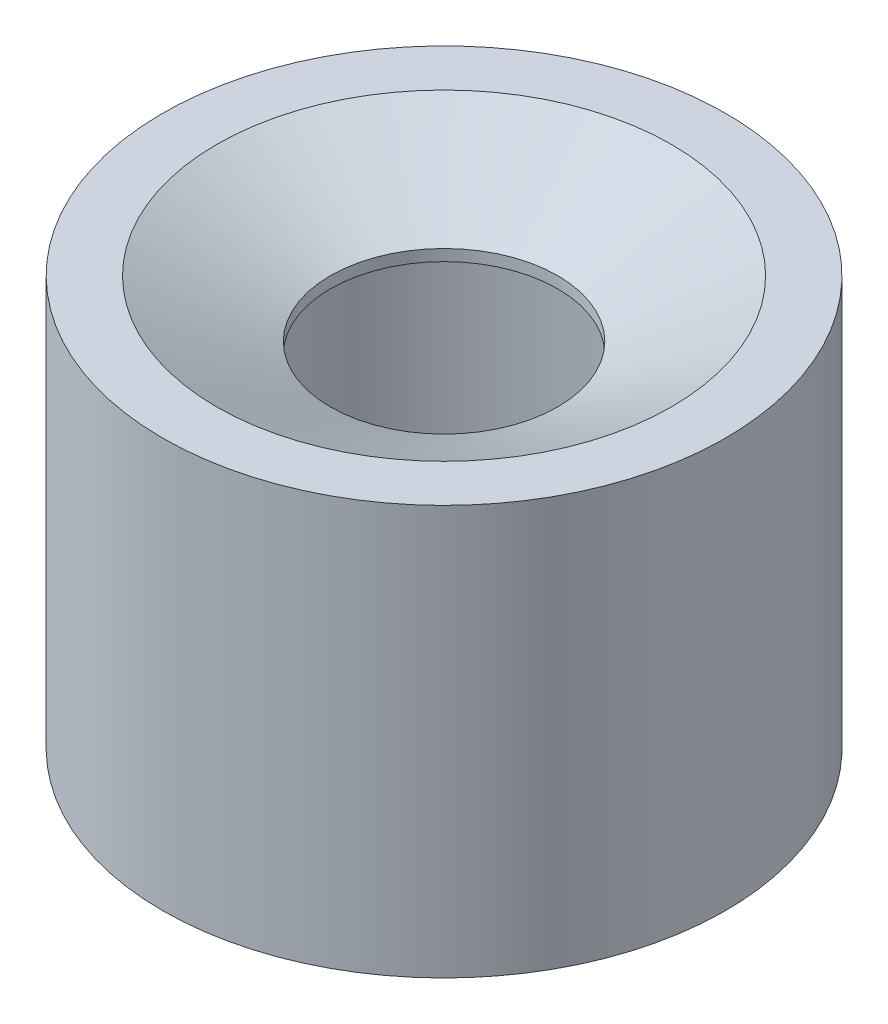
from build123d import *

# Parameters (mm, degrees)
SKETCH1_R           = 2.475
SKETCH1_R_2         = 1.975
BOSS_EXTRUDE1_DEPTH = 3
SKETCH2_R           = 2.475
SKETCH2_R_2         = 1
BOSS_EXTRUDE2_DEPTH = 0.6
CHAMFER1_SIZE       = 1
CHAMFER1_SIZE2      = 0.5


with BuildPart() as part:
    # Sketch1 → Boss-Extrude1 (new body)
    with BuildSketch(Plane(origin=(0, 0, 0), x_dir=(1, 0, 0), z_dir=(0, 1, 0))):
        with Locations(Location((0, 0, 0), (0, 0, 270))):
            Circle(SKETCH1_R)
        with Locations(Location((0, 0, 0), (0, 0, 270))):
            Circle(SKETCH1_R_2, mode=Mode.SUBTRACT)
    extrude(amount=BOSS_EXTRUDE1_DEPTH)

    # Sketch2 → Boss-Extrude2 (add)
    with BuildSketch(Plane(origin=(0, 3, 0), x_dir=(1, 0, 0), z_dir=(0, 1, 0))):
        with Locations(Location((0, 0, 0), (0, 0, 270))):
            Circle(SKETCH2_R)
        with Locations(Location((0, 0, 0), (0, 0, 270))):
            Circle(SKETCH2_R_2, mode=Mode.SUBTRACT)
    extrude(amount=BOSS_EXTRUDE2_DEPTH)

    # Chamfer1
    chamfer1_edges = [part.edges().sort_by_distance(p)[0] for p in [
        (0, 3.6, -1),
    ]]
    chamfer1_side = [part.faces().sort_by_distance(p)[0] for p in [
        (0, 3.6, -2.404996429),
    ]]
    chamfer(chamfer1_edges, length=CHAMFER1_SIZE, length2=CHAMFER1_SIZE2, reference=chamfer1_side[0])


solid = part.part
